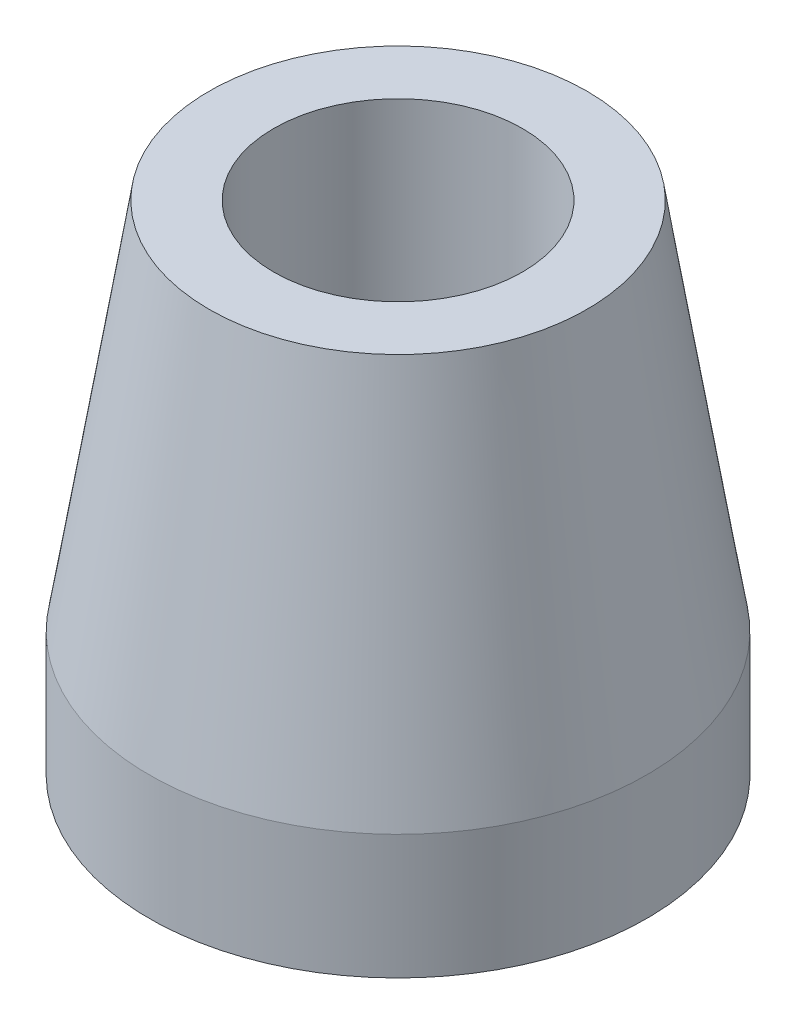
from build123d import *


with BuildPart() as part:
    # Sketch1 → Revolve1 (revolve)
    with BuildSketch(Plane.XY, mode=Mode.PRIVATE) as revolve1_sk:
        Polygon((0, 0), (2.5, 0), (2.5, 7.5), (3.797468354, 7.5), (5, 0), (5, -2.5), (0, -2.5), align=None)
    revolve(revolve1_sk.sketch.rotate(Axis((0, -2.5, 0), (0, 1, 0)), 90), axis=Axis((0, -2.5, 0), (0, 1, 0)))


solid = part.part
